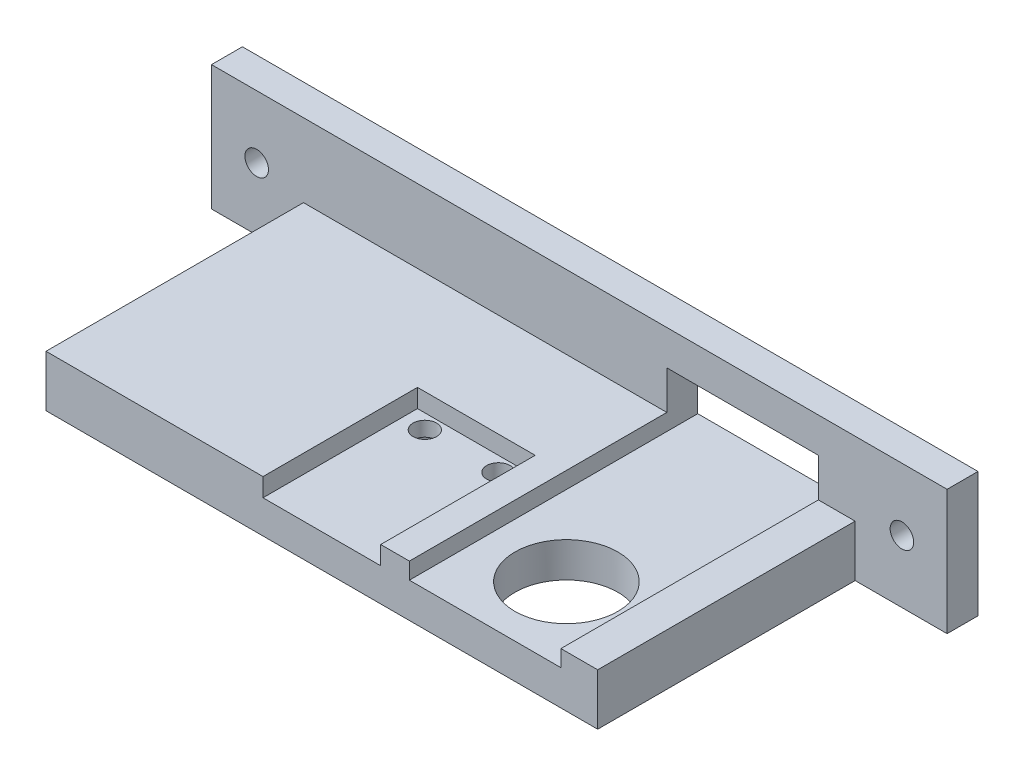
from build123d import *

# Parameters (mm, degrees)
SKETCH1_W                 = 75
SKETCH1_H                 = 16.798090687
SKETCH1_H_2               = 35
BODY_DEPTH                = 7
SKETCH3_W                 = 16
SKETCH3_H                 = 21
CHIP_DIVET_DEPTH          = 2.5
SKETCH4_R                 = 1.6
CHIP_MOUNTING_HOLES_DEPTH = 58.827758025
CHIP_CAPTIVE_NUTS_DEPTH   = 2.5
SKETCH6_R                 = 7
ROUTING_HOLE_DEPTH        = 59.075809062
SKETCH7_W                 = 100
SKETCH7_H                 = 4.201909313
FACE_PLATE_DEPTH          = 10
SKETCH8_W                 = 20.6
SKETCH8_H                 = 7.5
SWITCH_HOLE_DEPTH         = 66.770735847
SKETCH2_R                 = 1.6
MOUNTING_HOLES_DEPTH      = 66.770735847


with BuildPart() as part:
    # Sketch1 → body (new body)
    with BuildSketch(Plane(origin=(0, 0, 0), x_dir=(1, 0, 0), z_dir=(0, 1, 0))):
        Polygon((-50, 6.298090687), (-37.5, 6.298090687), (37.5, 6.298090687), (50, 6.298090687), (50, 10.5), (-50, 10.5), align=None)
        with Locations((0, -2.100954656)):
            Rectangle(SKETCH1_W, SKETCH1_H)
        with Locations((0, -11.201909313)):
            Rectangle(SKETCH1_W, SKETCH1_H_2)
    extrude(amount=BODY_DEPTH)

    # Sketch3 → chip-divet (cut)
    with BuildSketch(Plane(origin=(0, 7, 0), x_dir=(1, 0, 0), z_dir=(0, 1, 0))):
        with Locations((0, -18.201909313)):
            Rectangle(SKETCH3_W, SKETCH3_H)
    extrude(amount=-CHIP_DIVET_DEPTH, mode=Mode.SUBTRACT)

    # Sketch4 → chip-mounting-holes (cut, through all)
    with BuildSketch(Plane(origin=(0, 4.5, 0), x_dir=(1, 0, 0), z_dir=(0, 1, 0))):
        with Locations(Location((-5, -9.701909313, 0), (0, 0, 270))):
            Circle(SKETCH4_R)
        with Locations(Location((5, -9.701909313, 0), (0, 0, 270))):
            Circle(SKETCH4_R)
    extrude(amount=-CHIP_MOUNTING_HOLES_DEPTH, mode=Mode.SUBTRACT)

    # Sketch5 → chip-captive-nuts (cut)
    with BuildSketch(Plane.XZ):
        Polygon((6.21170825, 12.555286806), (3.13475673, 12.177968186), (1.92304848, 9.324590694), (3.78829175, 6.848531821), (6.86524327, 7.22585044), (8.07695152, 10.079227933), align=None)
        Polygon((-3.78829175, 12.555286806), (-6.86524327, 12.177968186), (-8.07695152, 9.324590694), (-6.21170825, 6.848531821), (-3.13475673, 7.22585044), (-1.92304848, 10.079227933), align=None)
    extrude(amount=-CHIP_CAPTIVE_NUTS_DEPTH, mode=Mode.SUBTRACT)

    # Sketch6 → routing-hole (cut, through all)
    with BuildSketch(Plane(origin=(0, 7, 0), x_dir=(1, 0, 0), z_dir=(0, 1, 0))):
        with Locations(Location((22.75, -18.201909313, 0), (0, 0, 270))):
            Circle(SKETCH6_R)
    extrude(amount=-ROUTING_HOLE_DEPTH, mode=Mode.SUBTRACT)

    # Sketch7 → face-plate (add)
    with BuildSketch(Plane(origin=(0, 7, 0), x_dir=(1, 0, 0), z_dir=(0, 1, 0))):
        with Locations((0, 8.399045343)):
            Rectangle(SKETCH7_W, SKETCH7_H)
    extrude(amount=FACE_PLATE_DEPTH)

    # Sketch8 → switch-hole (cut, through all)
    with BuildSketch(Plane(origin=(0, 0, -10.5), x_dir=(-1, 0, 0), z_dir=(0, 0, -1))):
        with Locations((-22.2, 8.5)):
            Rectangle(SKETCH8_W, SKETCH8_H)
    extrude(amount=-SWITCH_HOLE_DEPTH, mode=Mode.SUBTRACT)

    # Sketch2 → mounting-holes (cut, through all)
    with BuildSketch(Plane(origin=(0, 0, -10.5), x_dir=(-1, 0, 0), z_dir=(0, 0, -1))):
        with Locations((-43.86, 8.5)):
            Circle(SKETCH2_R)
        with Locations((43.86, 8.5)):
            Circle(SKETCH2_R)
    extrude(amount=-MOUNTING_HOLES_DEPTH, mode=Mode.SUBTRACT)


solid = part.part
